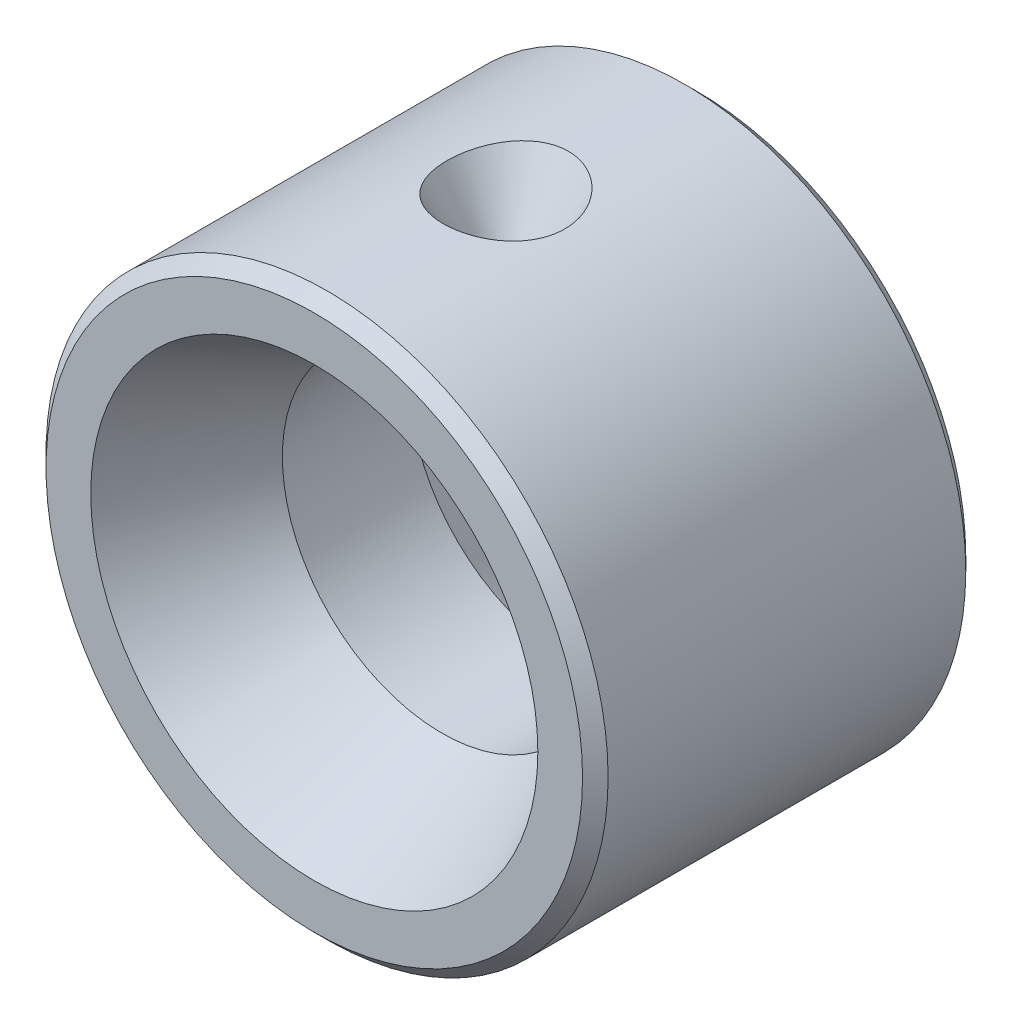
from build123d import *

# Parameters (mm, degrees)
SKETCH1_R           = 22
SKETCH1_R_2         = 12.5
BOSS_EXTRUDE1_DEPTH = 15
CHAMFER1_SIZE       = 1
CHAMFER2_SIZE       = 5
CHAMFER2_SIZE2      = 10
CHAMFER3_SIZE       = 10
CHAMFER3_SIZE2      = 5


with BuildPart() as part:
    # Sketch1 → Boss-Extrude1 (new, symmetric)
    with BuildSketch(Plane.XY):
        Circle(SKETCH1_R)
        Circle(SKETCH1_R_2, mode=Mode.SUBTRACT)
    extrude(amount=BOSS_EXTRUDE1_DEPTH, both=True)

    # Chamfer1
    chamfer1_edges = [part.edges().sort_by_distance(p)[0] for p in [
        (-22, 0, -15),
        (-22, 0, 15),
    ]]
    chamfer(chamfer1_edges, length=CHAMFER1_SIZE)

    # Chamfer2
    chamfer2_edges = [part.edges().sort_by_distance(p)[0] for p in [
        (-12.5, 0, 15),
    ]]
    chamfer2_side = [part.faces().sort_by_distance(p)[0] for p in [
        (-20.406030304, 0, 15),
    ]]
    chamfer(chamfer2_edges, length=CHAMFER2_SIZE, length2=CHAMFER2_SIZE2, reference=chamfer2_side[0])

    # Chamfer3
    chamfer3_edges = [part.edges().sort_by_distance(p)[0] for p in [
        (-12.5, 0, -15),
    ]]
    chamfer3_side = [part.faces().sort_by_distance(p)[0] for p in [
        (-12.5, 0, -5),
    ]]
    chamfer(chamfer3_edges, length=CHAMFER3_SIZE, length2=CHAMFER3_SIZE2, reference=chamfer3_side[0])

    # Sketch2 → Cut-Revolve1 (revolve, cut)
    with BuildSketch(Plane(origin=(-103.136389545, -329.994936254, 0), x_dir=(-1, 0, 0), z_dir=(0, 0, 1)), mode=Mode.PRIVATE) as cut_revolve1_sk:
        Polygon((-103.136389545, -304.994936254), (-103.136389545, -316.494936254), (-96.496861449, -304.994936254), align=None)
    cut_revolve1 = revolve(cut_revolve1_sk.sketch.rotate(Axis((0, -25, 0), (0, 1, 0)), 270), axis=Axis((0, -25, 0), (0, 1, 0)), mode=Mode.SUBTRACT)

    # Mirror3: Cut-Revolve1 across plane
    add(cut_revolve1.mirror(Plane.ZX), mode=Mode.SUBTRACT)


solid = part.part
